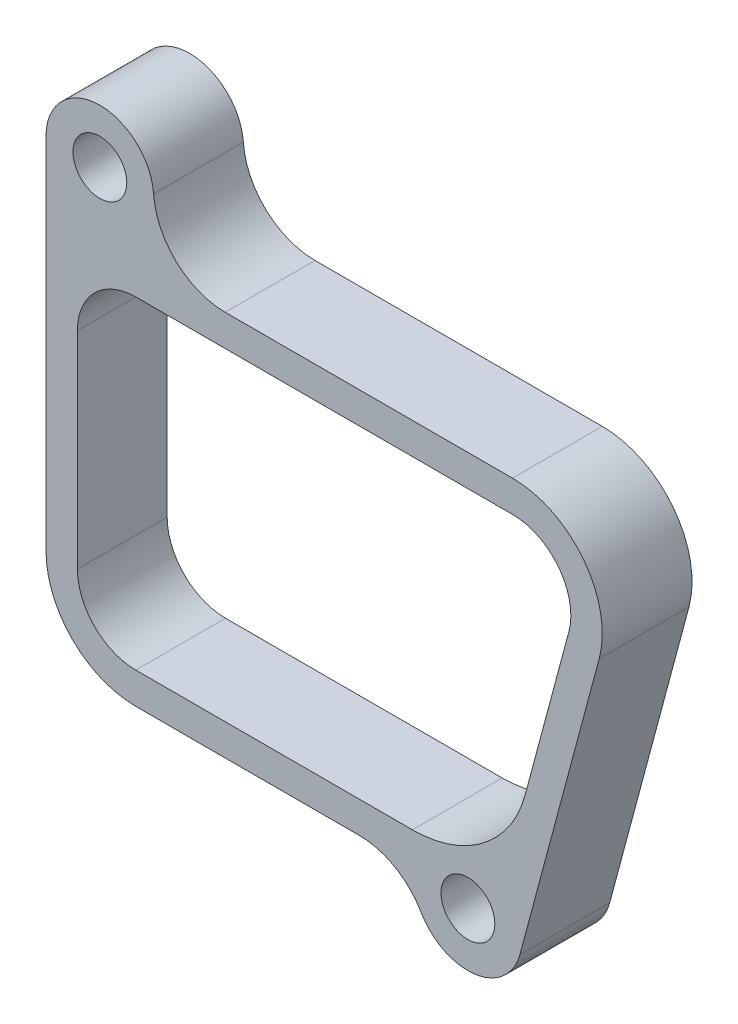
from build123d import *

# Parameters (mm, degrees)
SKETCH1_R           = 6
BOSS_EXTRUDE2_DEPTH = 10


with BuildPart() as part:
    # Sketch1 → Boss-Extrude2 (new, symmetric)
    with BuildSketch(Plane.XY):
        with BuildLine():
            ThreePointArc((27.928480088, -14), (17.026317786, -9.710800875), (11.969348609, 0.857142857))
            ThreePointArc((11.969348609, 0.857142857), (-0.428845364, 11.992334704), (-12, 0))
            Line((-12, 0), (-12, -80))
            ThreePointArc((-12, -80), (-6.142135624, -94.142135624), (8, -100))
            Line((8, -100), (57.751288694, -100))
            ThreePointArc((57.751288694, -100), (65.751288694, -102.143593539), (71.607695155, -108))
            ThreePointArc((71.607695155, -108), (83.566314307, -113.897338336), (93.591109915, -105.105828541))
            Line((93.591109915, -105.105828541), (111.256852168, -39.176380902))
            ThreePointArc((111.256852168, -39.176380902), (107.805402448, -21.82477142), (91.938335642, -14))
            Line((91.938335642, -14), (27.928480088, -14))
        make_face()
        with Locations((82, -102)):
            Circle(SKETCH1_R, mode=Mode.SUBTRACT)
        with BuildLine():
            Line((-5, -80), (-5, -34))
            ThreePointArc((-5, -34), (-1.192388155, -24.807611845), (8, -21))
            Line((8, -21), (91.938335642, -21))
            ThreePointArc((91.938335642, -21), (102.251929066, -26.086101423), (104.495371384, -37.364647586))
            Line((104.495371384, -37.364647586), (94.75149343, -73.729295173))
            ThreePointArc((94.75149343, -73.729295173), (85.465219101, -87.627186848), (69.637421946, -93))
            Line((69.637421946, -93), (8, -93))
            ThreePointArc((8, -93), (-1.192388155, -89.192388155), (-5, -80))
        make_face(mode=Mode.SUBTRACT)
        Circle(SKETCH1_R, mode=Mode.SUBTRACT)
    extrude(amount=BOSS_EXTRUDE2_DEPTH, both=True)


solid = part.part
